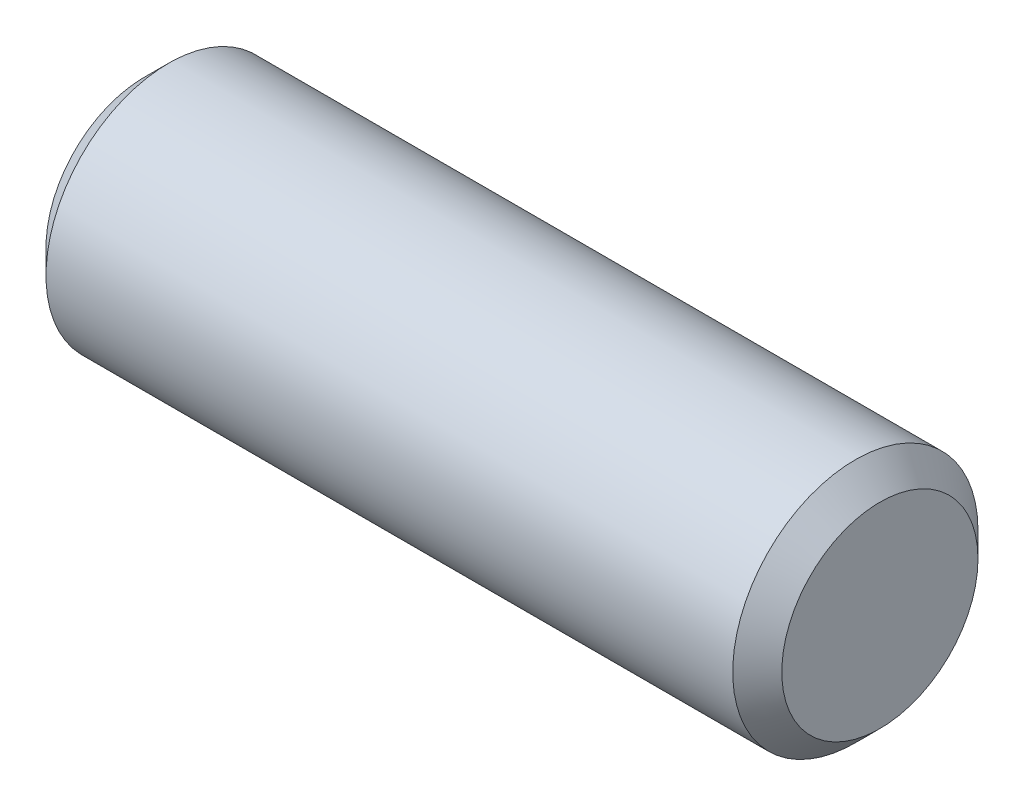
from build123d import *

# Parameters (mm, degrees)
EXTRUDE1_DEPTH      = 1.190625
EXTRUDE1_DEPTH_BACK = 1.190625
SKETCH2_R           = 0.396875
CHAMFER1_SIZE       = 0.079375


with BuildPart() as part:
    # Sketch2 → Extrude1 (new, two sides: drawn at the far end of the back side and taken through both)
    with BuildSketch(Plane(origin=(0, 0, 0), x_dir=(0, 0, -1), z_dir=(1, 0, 0)).offset(-EXTRUDE1_DEPTH_BACK)):
        Circle(SKETCH2_R)
    extrude(amount=EXTRUDE1_DEPTH + EXTRUDE1_DEPTH_BACK)

    # Chamfer1
    chamfer1_edges = [part.edges().sort_by_distance(p)[0] for p in [
        (-1.190625, 0, 0.396875),
        (1.190625, 0, 0.396875),
    ]]
    chamfer(chamfer1_edges, length=CHAMFER1_SIZE)


solid = part.part
